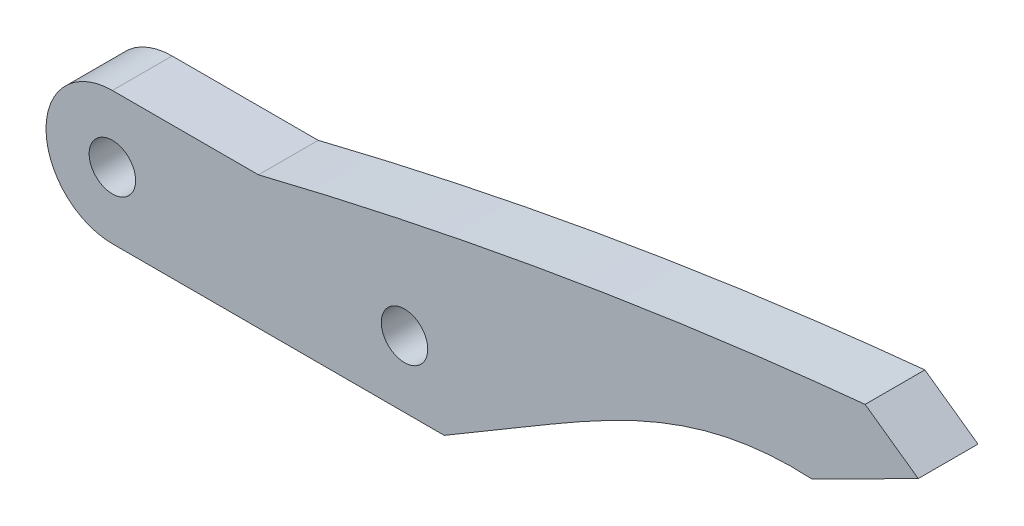
from build123d import *

# Parameters (mm, degrees)
SKETCH2_R           = 5
SKETCH2_R_2         = 1.75
BOSS_EXTRUDE1_DEPTH = 4.5
BOSS_EXTRUDE2_START = -4.5
BOSS_EXTRUDE2_DEPTH = 4.5


with BuildPart() as part:
    # Sketch2 → Boss-Extrude1 (new body)
    # profile 1 of 3: a face of its own
    with BuildSketch(Plane.XY):
        with Locations((-11, 0)):
            Circle(SKETCH2_R)
        with Locations((-11, 0)):
            Circle(SKETCH2_R_2, mode=Mode.SUBTRACT)
    # profile 2 of 3: a face of its own
    with BuildSketch(Plane.XY):
        with Locations((11, 0)):
            Circle(SKETCH2_R)
        with Locations((11, 0)):
            Circle(SKETCH2_R_2, mode=Mode.SUBTRACT)
    # profile 3 of 3: a face of its own
    with BuildSketch(Plane.XY):
        with BuildLine():
            Line((11.000000016, 5), (-11, 5))
            ThreePointArc((-11, 5), (-7.464466094, 3.535533906), (-6, 0))
            ThreePointArc((-6, 0), (-7.464466094, -3.535533906), (-11, -5))
            Line((-11, -5), (11, -5))
            ThreePointArc((11, -5), (6, 8e-09), (11.000000016, 5))
        make_face()
    extrude(amount=BOSS_EXTRUDE1_DEPTH)

    # Sketch3 → Boss-Extrude2 (add)
    with BuildSketch(Plane.XY.offset(4.5).offset(BOSS_EXTRUDE2_START)):
        with BuildLine():
            Line((49.688970331, 10.03), (45.688970331, 12.87))
            add(Edge.make_bspline(
                [(0, 5), (22.564264041, 10.590261298), (45.688970331, 12.87)],
                knots=[0, 0, 0, 1, 1, 1], degree=2))
            Line((0, 5), (11, 5))
            ThreePointArc((11, 5), (16, 0), (11, -5))
            Line((11, -5), (13.99, -5))
            Line((13.99, -5), (19.942130619, -1.48))
            add(Edge.make_bspline(
                [(41.688970331, 6), (33.285520943, 6.459476071), (26.91839773, 2.645658828), (19.942130619, -1.48)],
                knots=[0, 0, 0, 0, 1, 1, 1, 1], degree=3))
            Line((41.688970331, 6), (49.688970331, 10.03))
        make_face()
    extrude(amount=BOSS_EXTRUDE2_DEPTH)


solid = part.part
